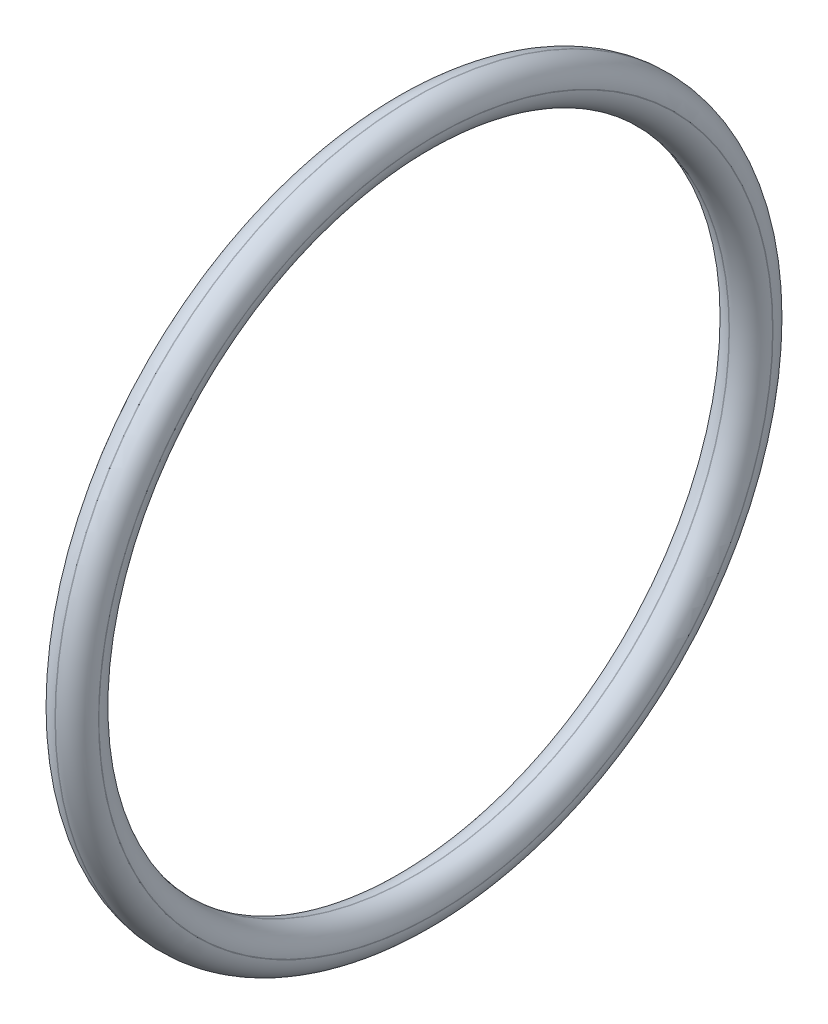
from build123d import *

# Parameters (mm, degrees)
ESBO_O2_R                = 7
ESBO_O2_R_2              = 6.15
RESSALTO_EXTRUS_O1_DEPTH = 0.85
FILETE5_R                = 0.42


with BuildPart() as part:
    # Esboço2 → Ressalto-extrusão1 (new body)
    with BuildSketch(Plane(origin=(0, 0, 0), x_dir=(0, 0, -1), z_dir=(1, 0, 0))):
        Circle(ESBO_O2_R)
        Circle(ESBO_O2_R_2, mode=Mode.SUBTRACT)
    extrude(amount=RESSALTO_EXTRUS_O1_DEPTH)

    # Filete5
    filete5_edges = [part.edges().sort_by_distance(p)[0] for p in [
        (0, 0, 7),
        (0.85, 0, 7),
        (0, 0, 6.15),
        (0.85, 0, 6.15),
    ]]
    fillet(filete5_edges, radius=FILETE5_R)


solid = part.part
